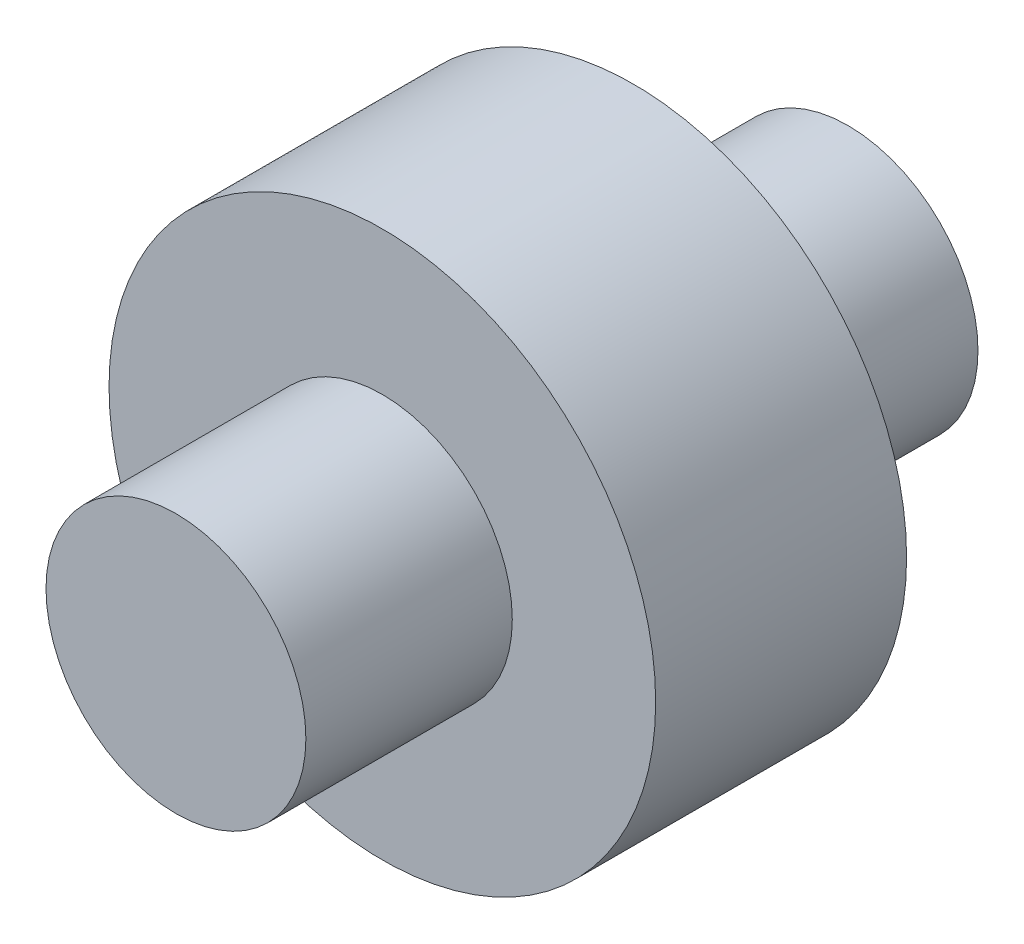
from build123d import *


with BuildPart() as part:
    # Sketch3 → Revolve1 (revolve)
    with BuildSketch(Plane(origin=(0, 0, 0), x_dir=(0, 0, -1), z_dir=(1, 0, 0)), mode=Mode.PRIVATE) as revolve1_sk:
        Polygon((-6.875165628, 1.8415), (-3.949933487, 1.8415), (-3.949933487, 3.8735), (-0.393933487, 3.8735), (-0.393933487, 1.8415), (2.649834372, 1.8415), (2.649834372, 0), (-6.875165628, 0), align=None)
    revolve(revolve1_sk.sketch.rotate(Axis((0, 0, 6.875165628), (0, 0, -1)), 90), axis=Axis((0, 0, 6.875165628), (0, 0, -1)))


solid = part.part
